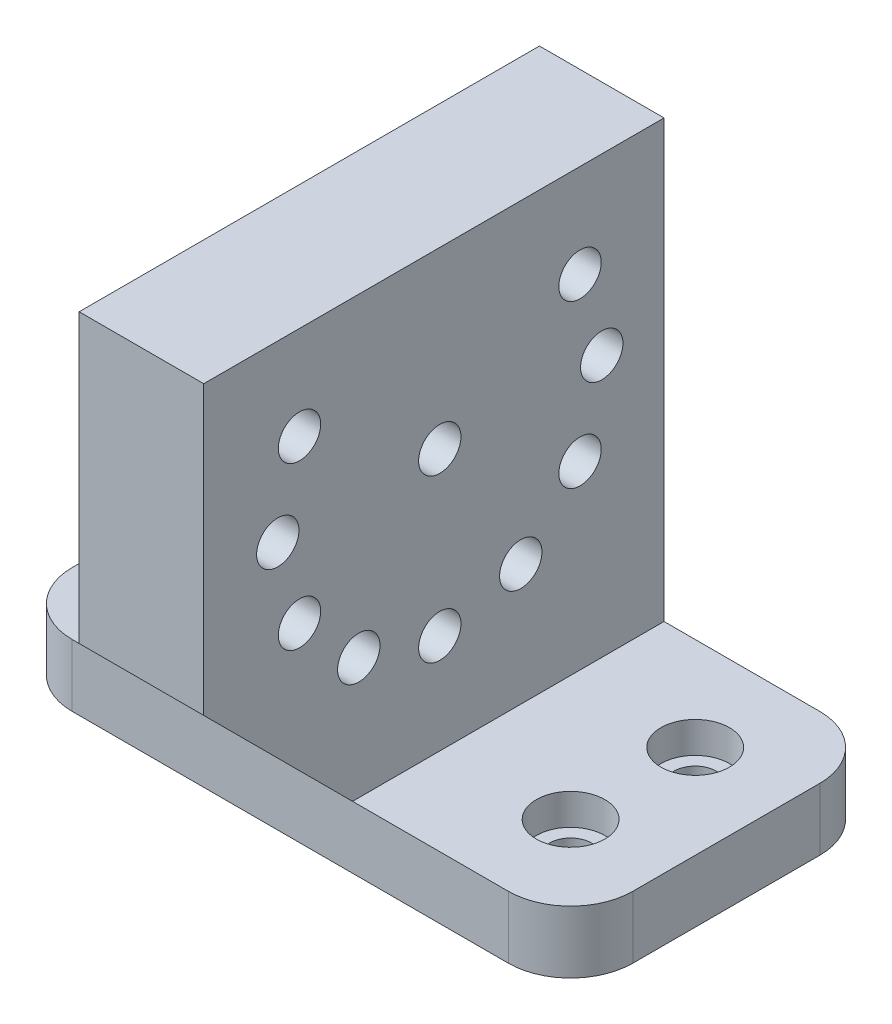
from build123d import *

# Parameters (mm, degrees)
SKETCH3_R           = 1.7
BOSS_EXTRUDE2_DEPTH = 5
SKETCH8_R           = 1.7
BOSS_EXTRUDE4_DEPTH = 5
SKETCH10_R          = 2.75
CUT_EXTRUDE1_DEPTH  = 2.5


with BuildPart() as part:
    # Sketch3 → Boss-Extrude2 (new body)
    with BuildSketch(Plane(origin=(0, 0, 0), x_dir=(1, 0, 0), z_dir=(0, 1, 0))):
        with BuildLine():
            Line((-17.5, -12.5), (17.5, -12.5))
            ThreePointArc((17.5, -12.5), (21.035533906, -11.035533906), (22.5, -7.5))
            Line((22.5, -7.5), (22.5, 7.5))
            ThreePointArc((22.5, 7.5), (21.035533906, 11.035533906), (17.5, 12.5))
            Line((17.5, 12.5), (-17.5, 12.5))
            ThreePointArc((-17.5, 12.5), (-21.035533906, 11.035533906), (-22.5, 7.5))
            Line((-22.5, 7.5), (-22.5, -7.5))
            ThreePointArc((-22.5, -7.5), (-21.035533906, -11.035533906), (-17.5, -12.5))
        make_face()
        with Locations(Location((-15, 5, 0), (0, 0, 270))):
            Circle(SKETCH3_R, mode=Mode.SUBTRACT)
        with Locations(Location((15, 5, 0), (0, 0, 90))):
            Circle(SKETCH3_R, mode=Mode.SUBTRACT)
        with Locations(Location((15, -5, 0), (0, 0, 270))):
            Circle(SKETCH3_R, mode=Mode.SUBTRACT)
        with Locations(Location((-15, -5, 0), (0, 0, 90))):
            Circle(SKETCH3_R, mode=Mode.SUBTRACT)
    extrude(amount=BOSS_EXTRUDE2_DEPTH)

    # Sketch8 → Boss-Extrude4 (add, symmetric)
    with BuildSketch(Plane(origin=(0, 0, 0), x_dir=(0, 0, -1), z_dir=(1, 0, 0))):
        Polygon((-12.5, 5), (12.5, 5), (12.5, 40), (-24.442906699, 40), (-24.442906699, 16.942906699), align=None)
        with Locations((-16.758330249, 19.5)):
            Circle(SKETCH8_R, mode=Mode.SUBTRACT)
        with Locations((-12, 14.741669751)):
            Circle(SKETCH8_R, mode=Mode.SUBTRACT)
        with Locations((-5.5, 13)):
            Circle(SKETCH8_R, mode=Mode.SUBTRACT)
        with Locations((1, 14.741669751)):
            Circle(SKETCH8_R, mode=Mode.SUBTRACT)
        with Locations((5.758330249, 19.5)):
            Circle(SKETCH8_R, mode=Mode.SUBTRACT)
        with Locations((-18.5, 26)):
            Circle(SKETCH8_R, mode=Mode.SUBTRACT)
        with Locations((-16.758330249, 32.5)):
            Circle(SKETCH8_R, mode=Mode.SUBTRACT)
        with Locations((-5.5, 26)):
            Circle(SKETCH8_R, mode=Mode.SUBTRACT)
        with Locations((7.5, 26)):
            Circle(SKETCH8_R, mode=Mode.SUBTRACT)
        with Locations((5.758330249, 32.5)):
            Circle(SKETCH8_R, mode=Mode.SUBTRACT)
    extrude(amount=BOSS_EXTRUDE4_DEPTH, both=True)

    # Sketch10 → Cut-Extrude1 (cut)
    with BuildSketch(Plane(origin=(0, 5, 0), x_dir=(1, 0, 0), z_dir=(0, 1, 0))):
        with Locations(Location((15, -5, 0), (0, 0, 270))):
            Circle(SKETCH10_R)
        with Locations(Location((-15, -5, 0), (0, 0, 270))):
            Circle(SKETCH10_R)
        with Locations(Location((-15, 5, 0), (0, 0, 270))):
            Circle(SKETCH10_R)
        with Locations(Location((15, 5, 0), (0, 0, 270))):
            Circle(SKETCH10_R)
    extrude(amount=-CUT_EXTRUDE1_DEPTH, mode=Mode.SUBTRACT)


solid = part.part
